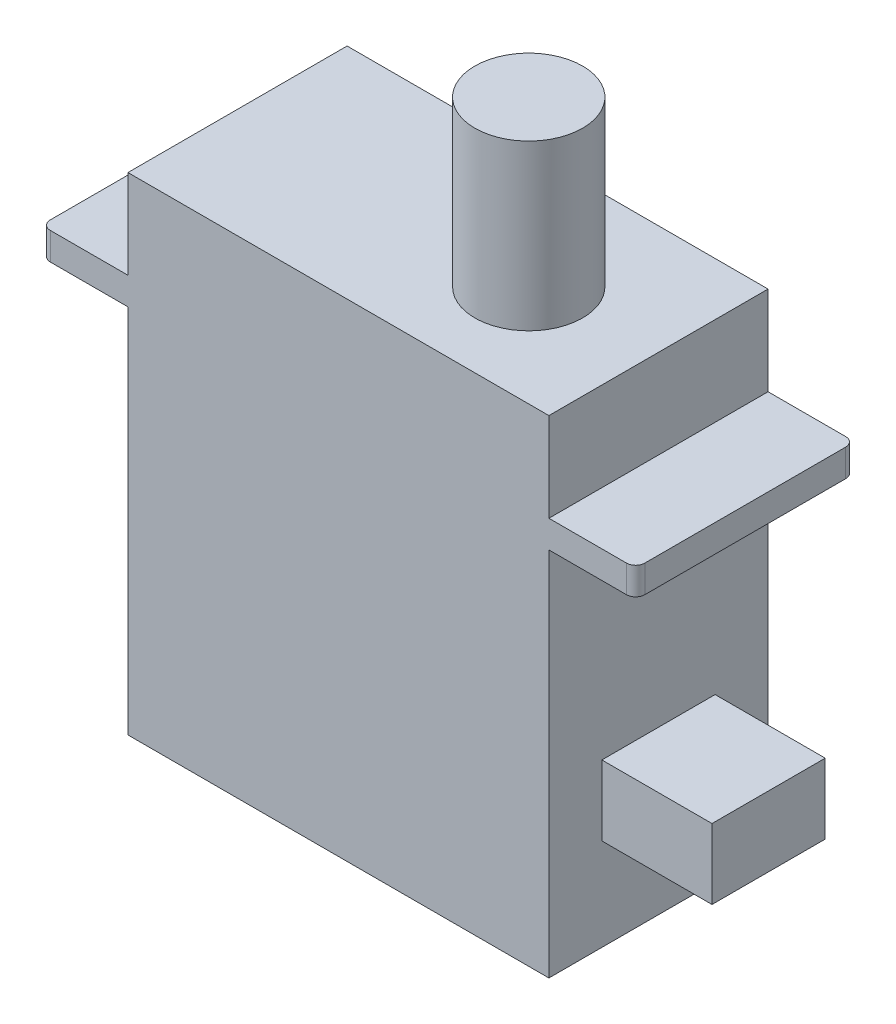
from build123d import *

# Parameters (mm, degrees)
SKETCH1_W           = 23.05
SKETCH1_H           = 26.67
BOSS_EXTRUDE1_DEPTH = 12
SKETCH2_W           = 12
SKETCH2_H           = 1.5
BOSS_EXTRUDE2_DEPTH = 4.75
FILLET1_R           = 0.5
SKETCH3_W           = 12
SKETCH3_H           = 1.5
BOSS_EXTRUDE3_DEPTH = 4.75
FILLET2_R           = 0.5
SKETCH4_W           = 6.2
SKETCH4_H           = 3.84
BOSS_EXTRUDE4_DEPTH = 6.03
SKETCH5_R           = 2.95
BOSS_EXTRUDE5_DEPTH = 9


with BuildPart() as part:
    # Sketch1 → Boss-Extrude1 (new body)
    with BuildSketch(Plane.XY):
        with Locations((11.525, 13.335)):
            Rectangle(SKETCH1_W, SKETCH1_H)
    extrude(amount=BOSS_EXTRUDE1_DEPTH)

    # Sketch2 → Boss-Extrude2 (add)
    with BuildSketch(Plane(origin=(23.05, 0, 0), x_dir=(0, 0, -1), z_dir=(1, 0, 0))):
        with Locations((-6, 21.05)):
            Rectangle(SKETCH2_W, SKETCH2_H)
    extrude(amount=BOSS_EXTRUDE2_DEPTH)

    # Fillet1
    fillet1_edges = [part.edges().sort_by_distance(p)[0] for p in [
        (27.8, 21.05, 12),
        (27.8, 21.05, 0),
    ]]
    fillet(fillet1_edges, radius=FILLET1_R)

    # Sketch3 → Boss-Extrude3 (add)
    with BuildSketch(Plane.ZY):
        with Locations((6, 21.05)):
            Rectangle(SKETCH3_W, SKETCH3_H)
    extrude(amount=BOSS_EXTRUDE3_DEPTH)

    # Fillet2
    fillet2_edges = [part.edges().sort_by_distance(p)[0] for p in [
        (-4.75, 21.05, 0),
        (-4.75, 21.05, 12),
    ]]
    fillet(fillet2_edges, radius=FILLET2_R)

    # Sketch4 → Boss-Extrude4 (add)
    with BuildSketch(Plane(origin=(23.05, 0, 0), x_dir=(0, 0, -1), z_dir=(1, 0, 0))):
        with Locations((-6, 6.97)):
            Rectangle(SKETCH4_W, SKETCH4_H)
    extrude(amount=BOSS_EXTRUDE4_DEPTH)

    # Sketch5 → Boss-Extrude5 (add)
    with BuildSketch(Plane(origin=(0, 26.67, 0), x_dir=(1, 0, 0), z_dir=(0, 1, 0))):
        with Locations(Location((16.395567503, -6.449737637, 0), (0, 0, 90))):
            Circle(SKETCH5_R)
    extrude(amount=BOSS_EXTRUDE5_DEPTH)


solid = part.part
